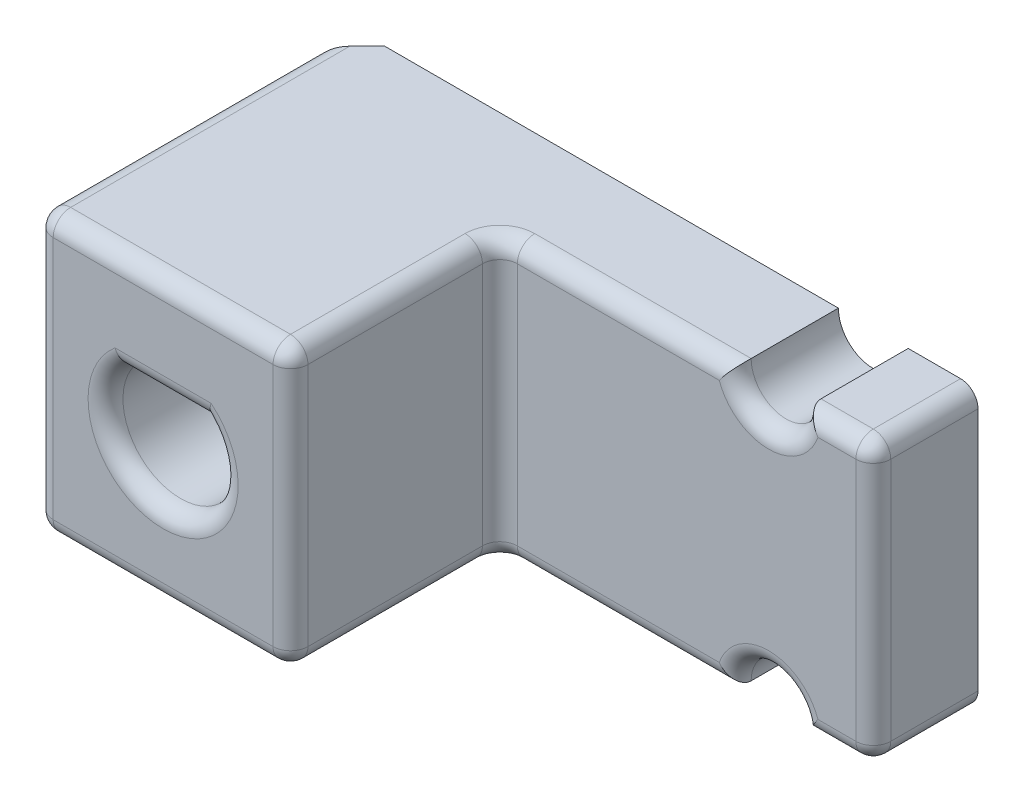
from build123d import *

# Parameters (mm, degrees)
SKETCH1_W           = 7.3
SKETCH1_H           = 8
BOSS_EXTRUDE1_DEPTH = 5
SKETCH1_3_W         = 7.3
SKETCH1_3_H         = 8
BOSS_EXTRUDE2_DEPTH = 1
BOSS_EXTRUDE3_DEPTH = 3
CHAMFER1_SIZE       = 1
FILLET1_R           = 0.5


with BuildPart() as part:
    # Sketch1 → Boss-Extrude1 (new body)
    with BuildSketch(Plane.XY):
        Rectangle(SKETCH1_W, SKETCH1_H)
        with BuildLine():
            Line((-1.183215957, 1.15), (1.183215957, 1.15))
            ThreePointArc((1.183215957, 1.15), (0, -1.65), (-1.183215957, 1.15))
        make_face(mode=Mode.SUBTRACT)
    extrude(amount=BOSS_EXTRUDE1_DEPTH)

    # Sketch1<3> → Boss-Extrude2 (add)
    with BuildSketch(Plane.XY):
        Rectangle(SKETCH1_3_W, SKETCH1_3_H)
    extrude(amount=-BOSS_EXTRUDE2_DEPTH)

    # Sketch2 → Boss-Extrude3 (add)
    with BuildSketch(Plane(origin=(0, 0, -1), x_dir=(-1, 0, 0), z_dir=(0, 0, -1))):
        with BuildLine():
            Line((3.65, -4), (3.65, 4))
            Line((3.65, 4), (-10.35, 4))
            ThreePointArc((-10.35, 4), (-11.35, 3), (-12.35, 4))
            Line((-12.35, 4), (-14.35, 4))
            Line((-14.35, 4), (-14.35, -4))
            Line((-14.35, -4), (-12.35, -4))
            ThreePointArc((-12.35, -4), (-11.35, -3), (-10.35, -4))
            Line((-10.35, -4), (3.65, -4))
        make_face()
    extrude(amount=BOSS_EXTRUDE3_DEPTH)

    # Chamfer1
    chamfer1_edges = [part.edges().sort_by_distance(p)[0] for p in [
        (-3.65, 0, -4),
    ]]
    chamfer(chamfer1_edges, length=CHAMFER1_SIZE)

    # Fillet1
    fillet1_edges = [part.edges().sort_by_distance(p)[0] for p in [
        (-3.65, -4, 1),
        (-3.65, 4, 1),
        (3.65, 4, 2),
        (3.65, -4, 2),
        (0, -4, 5),
        (3.65, 0, 5),
        (0, 4, 5),
        (3.65, 0, -1),
        (-3.65, 0, 5),
        (7, 4, -1),
        (11.35, 3, -1),
        (13.35, 4, -1),
        (14.35, 0, -1),
        (14.35, 4, -2.5),
        (14.35, -4, -2.5),
        (7, -4, -1),
        (11.35, -3, -1),
        (13.35, -4, -1),
        (0, 1.15, 5),
        (0, -1.65, 5),
    ]]
    fillet(fillet1_edges, radius=FILLET1_R)


solid = part.part
